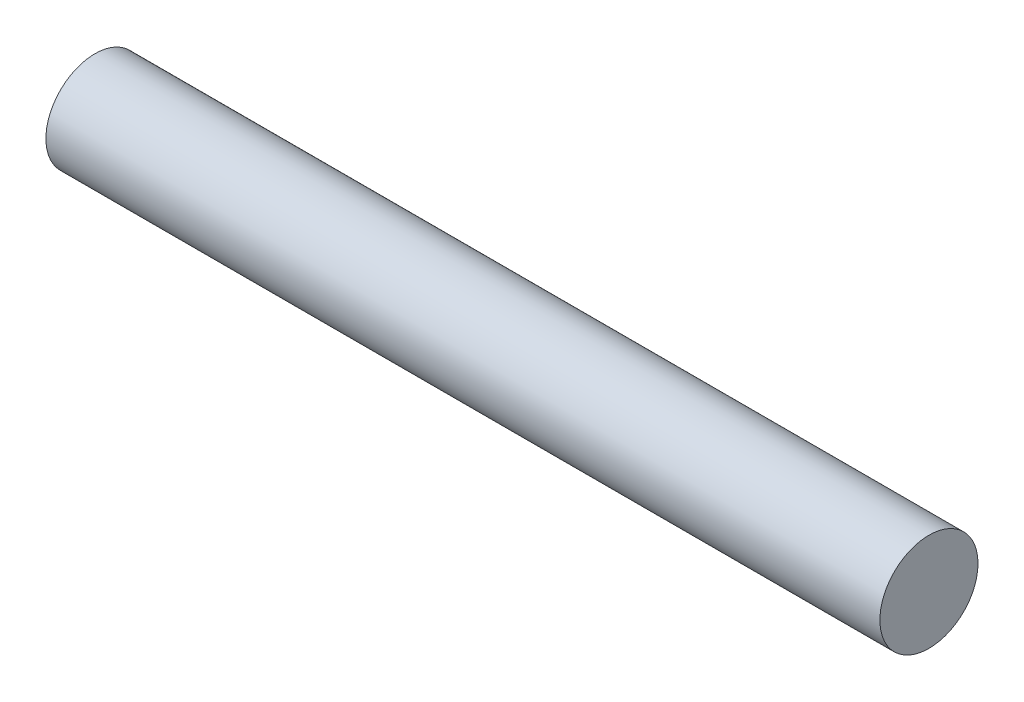
from build123d import *

# Parameters (mm, degrees)
SKETCH1_R           = 4
BOSS_EXTRUDE1_DEPTH = 68


with BuildPart() as part:
    # Sketch1 → Boss-Extrude1 (new body)
    with BuildSketch(Plane(origin=(0, 0, 0), x_dir=(0, 0, -1), z_dir=(1, 0, 0))):
        Circle(SKETCH1_R)
    extrude(amount=BOSS_EXTRUDE1_DEPTH)


solid = part.part
